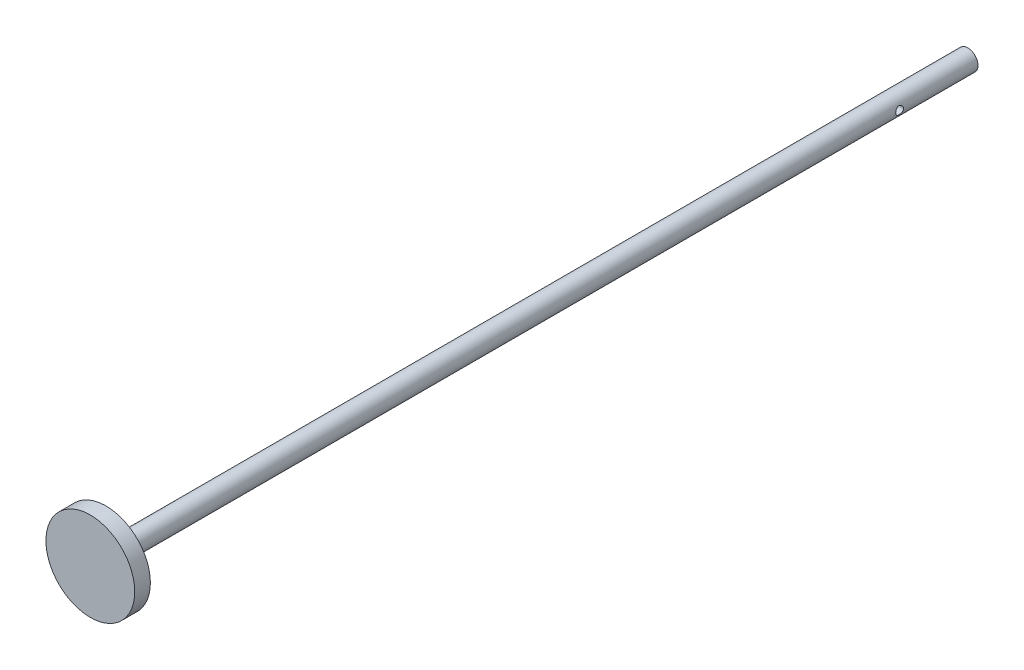
from build123d import *

# Parameters (mm, degrees)
SZKIC1_R                    = 1.95
DODANIE_WYCI_GNI_CIE1_DEPTH = 165
SZKIC2_R                    = 8.5
DODANIE_WYCI_GNI_CIE2_DEPTH = 3
SZKIC6_R                    = 0.75
WYTNIJ_WYCI_GNI_CIE2_DEPTH  = 11


with BuildPart() as part:
    # Szkic1 → Dodanie-wyciągnięcie1 (new body)
    with BuildSketch(Plane.XY):
        Circle(SZKIC1_R)
    extrude(amount=DODANIE_WYCI_GNI_CIE1_DEPTH)

    # Szkic2 → Dodanie-wyciągnięcie2 (add)
    with BuildSketch(Plane.XY.offset(165)):
        Circle(SZKIC2_R)
    extrude(amount=DODANIE_WYCI_GNI_CIE2_DEPTH)

    # Szkic6 → Wytnij-wyciągnięcie2 (cut)
    with BuildSketch(Plane.ZY.offset(1.95)):
        with Locations((15, 0)):
            Circle(SZKIC6_R)
    extrude(amount=-WYTNIJ_WYCI_GNI_CIE2_DEPTH, mode=Mode.SUBTRACT)


solid = part.part
